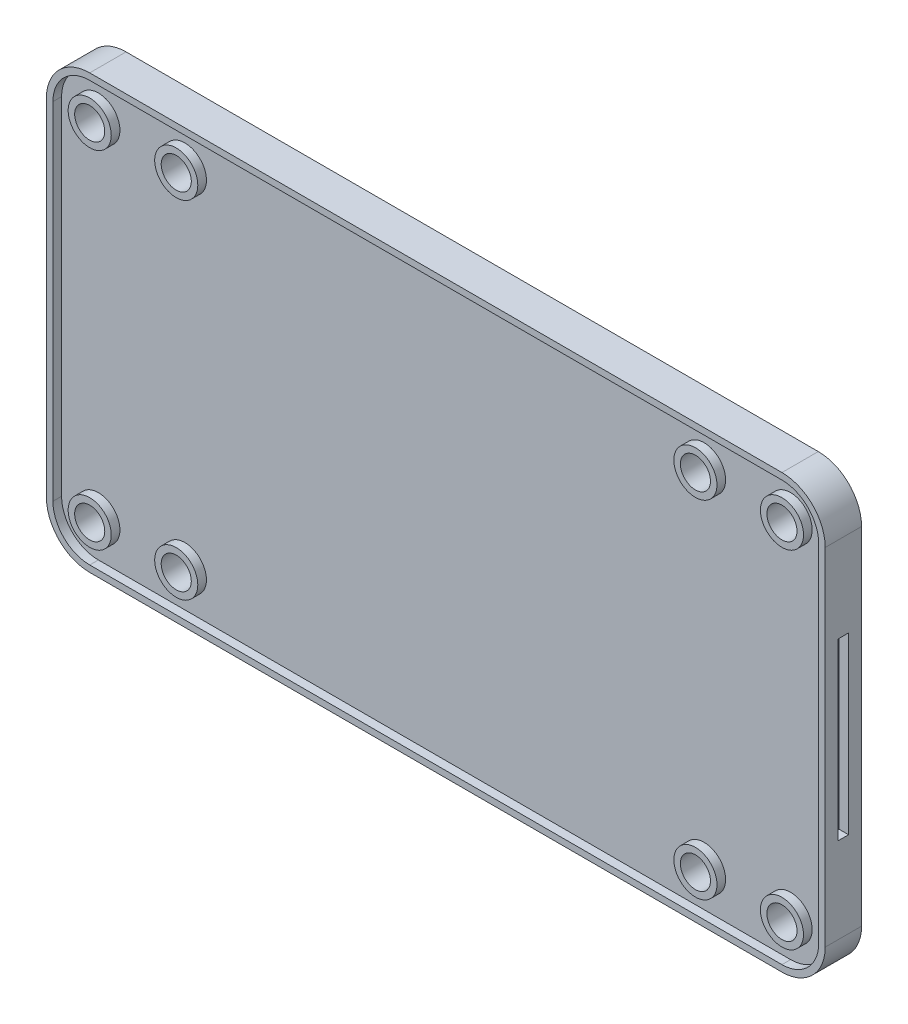
from build123d import *

# Parameters (mm, degrees)
SKETCH1_R           = 2.2098
BOSS_EXTRUDE1_DEPTH = 3.175
SKETCH2_R           = 3.1623
CUT_EXTRUDE3_DEPTH  = 1.27
SKETCH3_R           = 2.2098
BOSS_EXTRUDE2_DEPTH = 2.159
SKETCH4_W           = 1.524
SKETCH4_H           = 25.654
CUT_EXTRUDE4_DEPTH  = 1.397
SKETCH5_R           = 12.7
CUT_EXTRUDE5_DEPTH  = 2.54


with BuildPart() as part:
    # Sketch1 → Boss-Extrude1 (new body)
    with BuildSketch(Plane.XY):
        with BuildLine():
            Line((-50.8, -31.75), (50.8, -31.75))
            ThreePointArc((50.8, -31.75), (55.290128061, -29.890128061), (57.15, -25.4))
            Line((57.15, -25.4), (57.15, 25.4))
            ThreePointArc((57.15, 25.4), (55.290128061, 29.890128061), (50.8, 31.75))
            Line((50.8, 31.75), (-50.8, 31.75))
            ThreePointArc((-50.8, 31.75), (-55.290128061, 29.890128061), (-57.15, 25.4))
            Line((-57.15, 25.4), (-57.15, -25.4))
            ThreePointArc((-57.15, -25.4), (-55.290128061, -29.890128061), (-50.8, -31.75))
        make_face()
        with Locations((-50.8, -25.4)):
            Circle(SKETCH1_R, mode=Mode.SUBTRACT)
        with Locations((-38.1, -25.4)):
            Circle(SKETCH1_R, mode=Mode.SUBTRACT)
        with Locations(Location((-50.8, 25.4, 0), (0, 0, 180))):
            Circle(SKETCH1_R, mode=Mode.SUBTRACT)
        with Locations(Location((-38.1, 25.4, 0), (0, 0, 180))):
            Circle(SKETCH1_R, mode=Mode.SUBTRACT)
        with Locations((50.8, 25.4)):
            Circle(SKETCH1_R, mode=Mode.SUBTRACT)
        with Locations((38.1, 25.4)):
            Circle(SKETCH1_R, mode=Mode.SUBTRACT)
        with Locations(Location((50.8, -25.4, 0), (0, 0, 180))):
            Circle(SKETCH1_R, mode=Mode.SUBTRACT)
        with Locations(Location((38.1, -25.4, 0), (0, 0, 180))):
            Circle(SKETCH1_R, mode=Mode.SUBTRACT)
    extrude(amount=-BOSS_EXTRUDE1_DEPTH)

    # Sketch2 → Cut-Extrude3 (cut)
    with BuildSketch(Plane.XY):
        with BuildLine():
            Line((50.8, 30.7975), (-50.8, 30.7975))
            ThreePointArc((-50.8, 30.7975), (-54.616608851, 29.216608851), (-56.1975, 25.4))
            Line((-56.1975, 25.4), (-56.1975, -25.4))
            ThreePointArc((-56.1975, -25.4), (-54.616608851, -29.216608851), (-50.8, -30.7975))
            Line((-50.8, -30.7975), (50.8, -30.7975))
            ThreePointArc((50.8, -30.7975), (54.616608851, -29.216608851), (56.1975, -25.4))
            Line((56.1975, -25.4), (56.1975, 25.4))
            ThreePointArc((56.1975, 25.4), (54.616608851, 29.216608851), (50.8, 30.7975))
        make_face()
        with Locations((38.1, 25.4)):
            Circle(SKETCH2_R, mode=Mode.SUBTRACT)
        with Locations((50.8, 25.4)):
            Circle(SKETCH2_R, mode=Mode.SUBTRACT)
        with Locations((50.8, -25.4)):
            Circle(SKETCH2_R, mode=Mode.SUBTRACT)
        with Locations((38.1, -25.4)):
            Circle(SKETCH2_R, mode=Mode.SUBTRACT)
        with Locations((-38.1, -25.4)):
            Circle(SKETCH2_R, mode=Mode.SUBTRACT)
        with Locations((-50.8, -25.4)):
            Circle(SKETCH2_R, mode=Mode.SUBTRACT)
        with Locations((-38.1, 25.4)):
            Circle(SKETCH2_R, mode=Mode.SUBTRACT)
        with Locations((-50.8, 25.4)):
            Circle(SKETCH2_R, mode=Mode.SUBTRACT)
    extrude(amount=-CUT_EXTRUDE3_DEPTH, mode=Mode.SUBTRACT)

    # Sketch3 → Boss-Extrude2 (add)
    with BuildSketch(Plane(origin=(0, 0, -3.175), x_dir=(-1, 0, 0), z_dir=(0, 0, -1))):
        with BuildLine():
            Line((-57.15, 25.4), (-57.15, -25.4))
            ThreePointArc((-57.15, -25.4), (-55.290128061, -29.890128061), (-50.8, -31.75))
            Line((-50.8, -31.75), (50.8, -31.75))
            ThreePointArc((50.8, -31.75), (55.290128061, -29.890128061), (57.15, -25.4))
            Line((57.15, -25.4), (57.15, 25.4))
            ThreePointArc((57.15, 25.4), (55.290128061, 29.890128061), (50.8, 31.75))
            Line((50.8, 31.75), (-50.8, 31.75))
            ThreePointArc((-50.8, 31.75), (-55.290128061, 29.890128061), (-57.15, 25.4))
        make_face()
        with Locations((-50.8, -25.4)):
            Circle(SKETCH3_R, mode=Mode.SUBTRACT)
        with Locations((-38.1, -25.4)):
            Circle(SKETCH3_R, mode=Mode.SUBTRACT)
        with Locations(Location((38.1, -25.4, 0), (0, 0, 180))):
            Circle(SKETCH3_R, mode=Mode.SUBTRACT)
        with Locations(Location((50.8, -25.4, 0), (0, 0, 180))):
            Circle(SKETCH3_R, mode=Mode.SUBTRACT)
        with Locations((50.8, 25.4)):
            Circle(SKETCH3_R, mode=Mode.SUBTRACT)
        with Locations((38.1, 25.4)):
            Circle(SKETCH3_R, mode=Mode.SUBTRACT)
        with Locations(Location((-38.1, 25.4, 0), (0, 0, 180))):
            Circle(SKETCH3_R, mode=Mode.SUBTRACT)
        with Locations(Location((-50.8, 25.4, 0), (0, 0, 180))):
            Circle(SKETCH3_R, mode=Mode.SUBTRACT)
    extrude(amount=BOSS_EXTRUDE2_DEPTH)

    # Sketch4 → Cut-Extrude4 (cut)
    with BuildSketch(Plane(origin=(57.15, 0, 0), x_dir=(0, 0, -1), z_dir=(1, 0, 0))):
        with Locations((2.667, 0)):
            Rectangle(SKETCH4_W, SKETCH4_H)
    cut_extrude4 = extrude(amount=-CUT_EXTRUDE4_DEPTH, mode=Mode.SUBTRACT)

    # Mirror1: Cut-Extrude4 across plane
    add(cut_extrude4.mirror(Plane(origin=(0, 0, 0), x_dir=(0, 0, 1), z_dir=(1, 0, 0))), mode=Mode.SUBTRACT)

    # Sketch5 → Cut-Extrude5 (cut)
    with BuildSketch(Plane(origin=(0, 0, -5.334), x_dir=(-1, 0, 0), z_dir=(0, 0, -1))):
        Circle(SKETCH5_R)
    extrude(amount=-CUT_EXTRUDE5_DEPTH, mode=Mode.SUBTRACT)


solid = part.part
